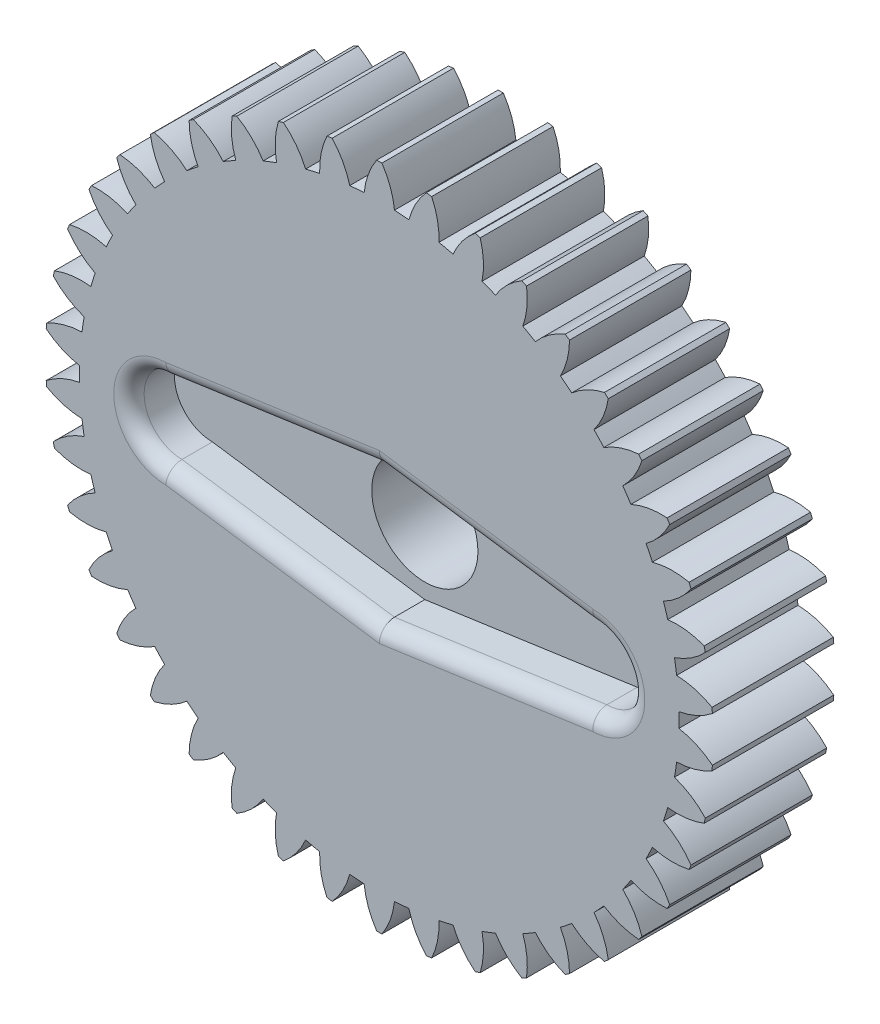
from build123d import *

# Parameters (mm, degrees)
SKETCH1_R               = 3.5
BOSS_EXTRUDE1_DEPTH     = 8
BOSS_EXTRUDE2_DEPTH     = 8
CIRPATTERN1_COUNT       = 42
CUT_EXTRUDE1_DEPTH      = 33.091442752
CUT_EXTRUDE1_DEPTH_BACK = 3
FILLET1_R               = 1


with BuildPart() as part:
    # Sketch1 → Boss-Extrude1 (new body)
    with BuildSketch(Plane.XY):
        with BuildLine():
            ThreePointArc((19.75, 0), (14.314546797, 13.607213161), (1, 19.724667298))
            ThreePointArc((1, 19.724667298), (0, 19.75), (-1, 19.724667298))
            ThreePointArc((-1, 19.724667298), (-13.607213161, -14.314546797), (19.75, 0))
        make_face()
        Circle(SKETCH1_R, mode=Mode.SUBTRACT)
    extrude(amount=BOSS_EXTRUDE1_DEPTH)

    # Sketch1<3> → Boss-Extrude2 (add)
    with BuildSketch(Plane.XY):
        with BuildLine():
            ThreePointArc((1, 19.724667298), (0.725738501, 20.913222216), (0.171846623, 22))
            Line((0.171846623, 22), (-0.171846623, 22))
            ThreePointArc((-0.171846623, 22), (-0.725738501, 20.913222216), (-1, 19.724667298))
            ThreePointArc((-1, 19.724667298), (0, 19.75), (1, 19.724667298))
        make_face()
    boss_extrude2 = extrude(amount=BOSS_EXTRUDE2_DEPTH)

    # CirPattern1: Boss-Extrude2 ×42 about axis
    cirpattern1_axis = Axis((0, 0, 8), (0, 0, 1))
    for i in range(1, CIRPATTERN1_COUNT):
        add(boss_extrude2.rotate(cirpattern1_axis, i * 360 / CIRPATTERN1_COUNT))

    # Sketch2 → Cut-Extrude1 (cut, two sides: drawn at the far end of the back side and taken through both)
    with BuildSketch(Plane.XY.offset(8).offset(-CUT_EXTRUDE1_DEPTH_BACK)):
        with BuildLine():
            Line((-14, 2.5), (0, 4.5))
            Line((0, 4.5), (14, 2.5))
            ThreePointArc((14, 2.5), (16.5, 0), (14, -2.5))
            Line((14, -2.5), (0, -4.5))
            Line((0, -4.5), (-14, -2.5))
            ThreePointArc((-14, -2.5), (-16.5, 0), (-14, 2.5))
        make_face()
    extrude(amount=CUT_EXTRUDE1_DEPTH + CUT_EXTRUDE1_DEPTH_BACK, mode=Mode.SUBTRACT)

    # Fillet1
    fillet1_edges = [part.edges().sort_by_distance(p)[0] for p in [
        (-7, -3.5, 8),
        (7, -3.5, 8),
        (16.5, 0, 8),
        (7, 3.5, 8),
        (-16.5, 0, 8),
        (-7, 3.5, 8),
    ]]
    fillet(fillet1_edges, radius=FILLET1_R)


solid = part.part
